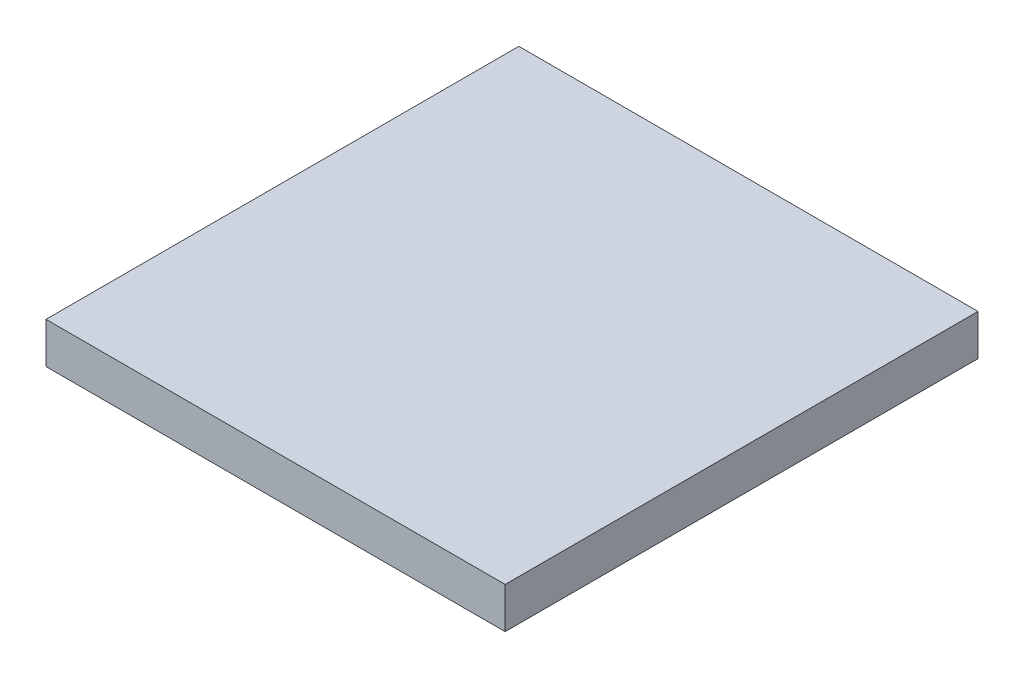
from build123d import *

# Parameters (mm, degrees)
SKETCH1_W           = 85.508293036
SKETCH1_H           = 88.060779395
BOSS_EXTRUDE1_DEPTH = 7.62


with BuildPart() as part:
    # Sketch1 → Boss-Extrude1 (new body)
    with BuildSketch(Plane(origin=(0, 0, 0), x_dir=(1, 0, 0), z_dir=(0, 1, 0))):
        with Locations((-2.187845451, 0.182320454)):
            Rectangle(SKETCH1_W, SKETCH1_H)
    extrude(amount=BOSS_EXTRUDE1_DEPTH)


solid = part.part
